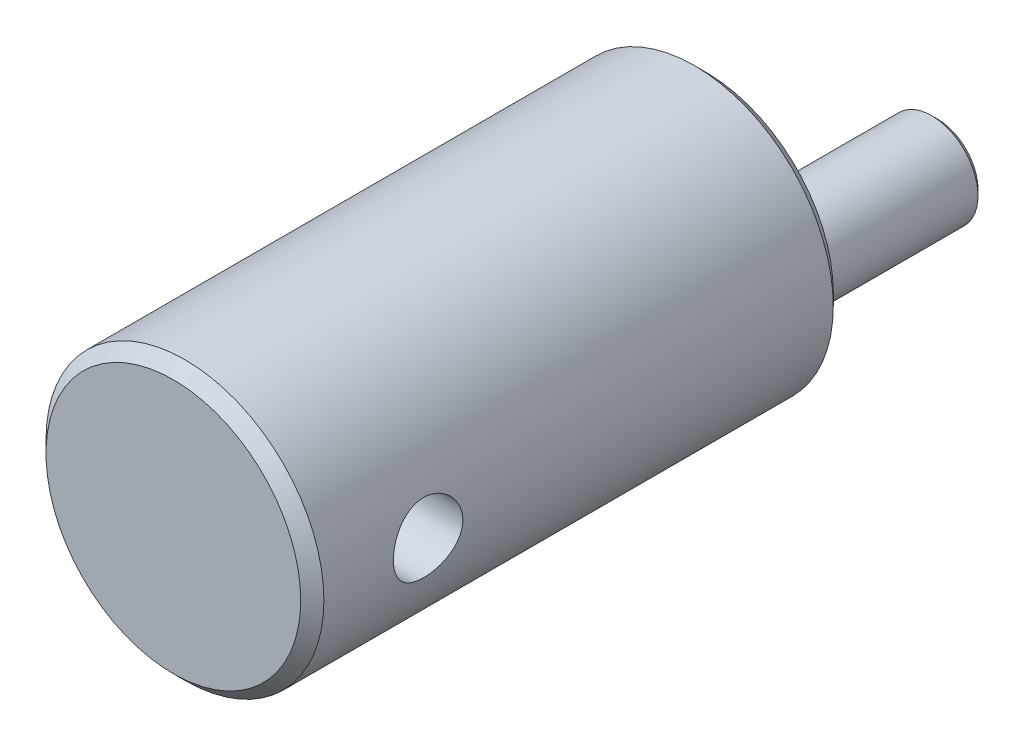
from build123d import *

# Parameters (mm, degrees)
SKETCH2_R           = 6
BOSS_EXTRUDE1_DEPTH = 23
CHAMFER1_SIZE       = 0.5
SKETCH3_R           = 1.5
CUT_EXTRUDE1_DEPTH  = 23
SKETCH5_R           = 2
BOSS_EXTRUDE2_DEPTH = 10
CHAMFER2_SIZE       = 0.25


with BuildPart() as part:
    # Sketch2 → Boss-Extrude1 (new body)
    with BuildSketch(Plane.XY):
        Circle(SKETCH2_R)
    extrude(amount=BOSS_EXTRUDE1_DEPTH)

    # Chamfer1
    chamfer1_edges = [part.edges().sort_by_distance(p)[0] for p in [
        (-6, 0, 0),
        (-6, 0, 23),
    ]]
    chamfer(chamfer1_edges, length=CHAMFER1_SIZE)

    # Sketch3 → Cut-Extrude1 (cut)
    with BuildSketch(Plane(origin=(-6, 0, 0), x_dir=(0, 0, -1), z_dir=(1, 0, 0))):
        with Locations(Location((-18, 0, 0), (0, 0, 180))):
            Circle(SKETCH3_R)
    extrude(amount=CUT_EXTRUDE1_DEPTH, mode=Mode.SUBTRACT)

    # Sketch5 → Boss-Extrude2 (add)
    with BuildSketch(Plane(origin=(0, 0, 0), x_dir=(-1, 0, 0), z_dir=(0, 0, -1))):
        with Locations(Location((0, -3, 0), (0, 0, 180))):
            Circle(SKETCH5_R)
    extrude(amount=BOSS_EXTRUDE2_DEPTH)

    # Chamfer2
    chamfer2_edges = [part.edges().sort_by_distance(p)[0] for p in [
        (-2, -3, -10),
    ]]
    chamfer(chamfer2_edges, length=CHAMFER2_SIZE)


solid = part.part
